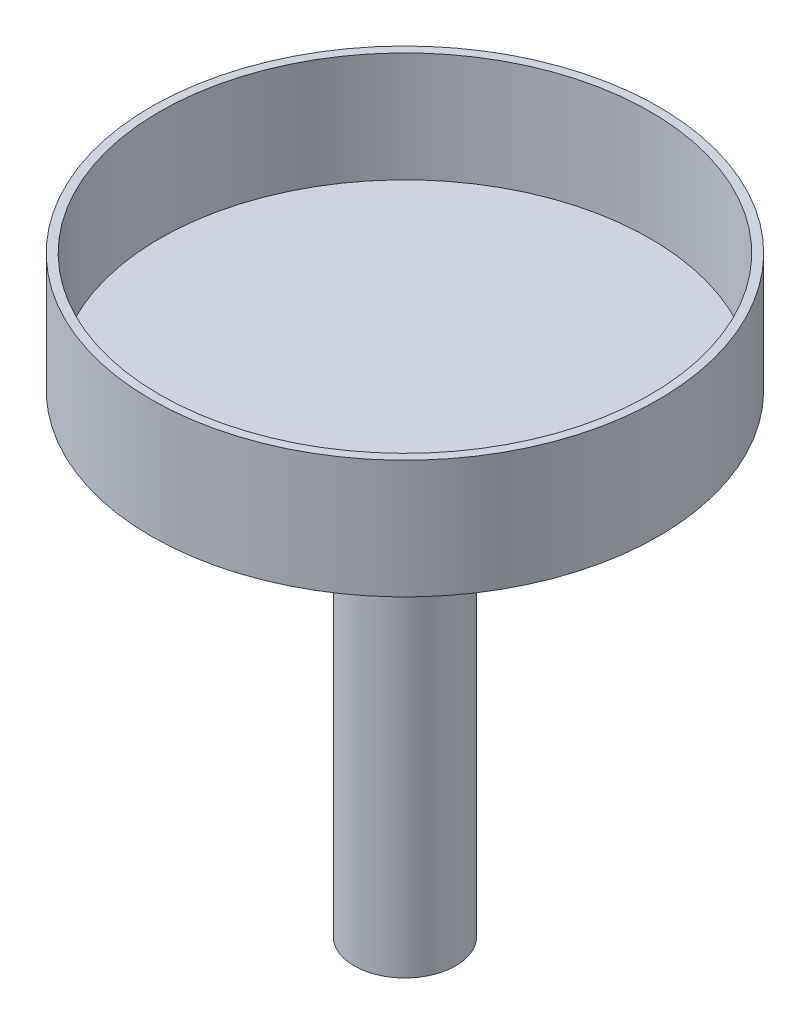
from build123d import *


with BuildPart() as part:
    # Sketch1 → Revolve1 (revolve)
    with BuildSketch(Plane.XY, mode=Mode.PRIVATE) as revolve1_sk:
        Polygon((30, -280), (30, 0), (150, 0), (150, 70), (145, 70), (145, 5), (0, 5), (0, -280), align=None)
    revolve(revolve1_sk.sketch.rotate(Axis((0, 21.6796875, 0), (0, -1, 0)), 90), axis=Axis((0, 21.6796875, 0), (0, -1, 0)))


solid = part.part
